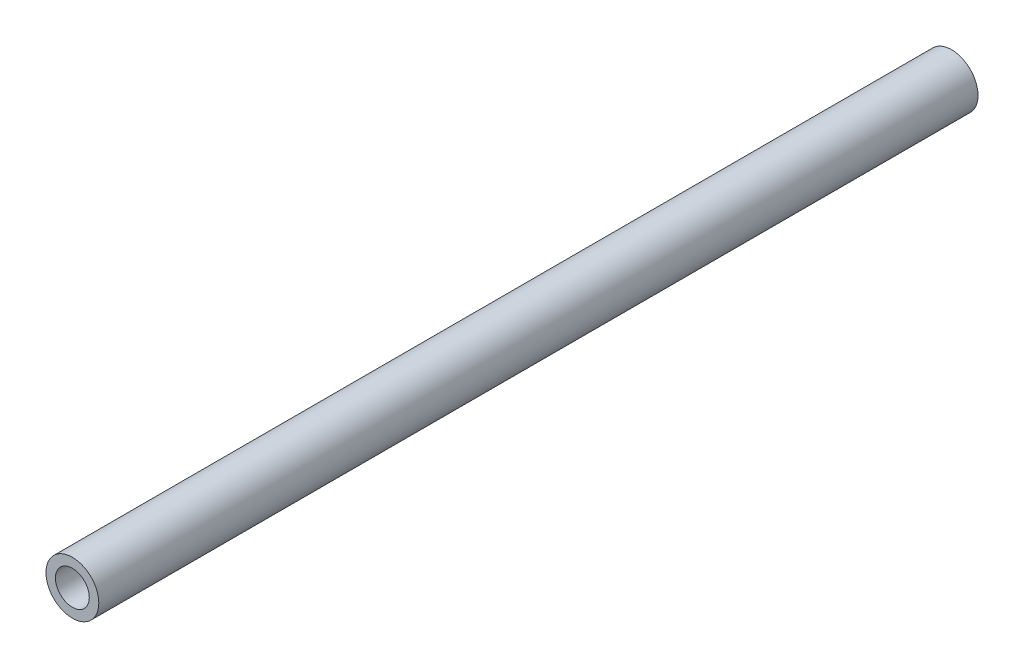
from build123d import *

# Parameters (mm, degrees)
SKETCH_1_R      = 2.5
SKETCH_1_R_2    = 1.6
EXTRUDE_1_DEPTH = 83.18


with BuildPart() as part:
    # 草图1 → 凸台-拉伸1 (new body)
    with BuildSketch(Plane.XY):
        Circle(SKETCH_1_R)
        Circle(SKETCH_1_R_2, mode=Mode.SUBTRACT)
    extrude(amount=EXTRUDE_1_DEPTH)


solid = part.part
